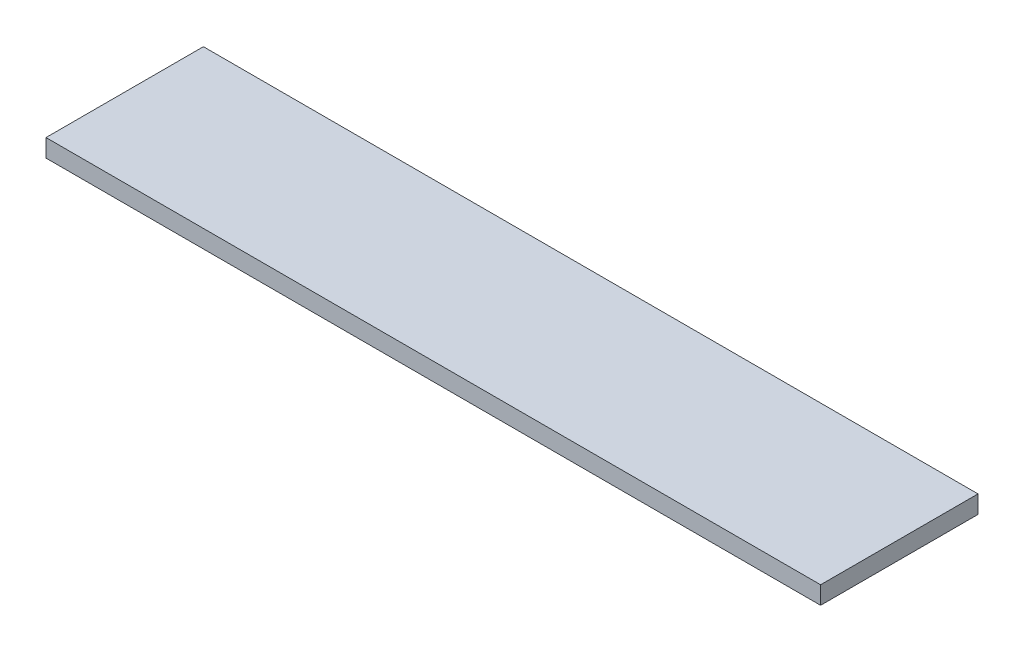
from build123d import *

# Parameters (mm, degrees)
SKETCH1_W           = 125
SKETCH1_H           = 25.4
BOSS_EXTRUDE1_DEPTH = 2.875


with BuildPart() as part:
    # Sketch1 → Boss-Extrude1 (new body)
    with BuildSketch(Plane(origin=(0, 0, 0), x_dir=(1, 0, 0), z_dir=(0, 1, 0))):
        Rectangle(SKETCH1_W, SKETCH1_H)
    extrude(amount=BOSS_EXTRUDE1_DEPTH)


solid = part.part
